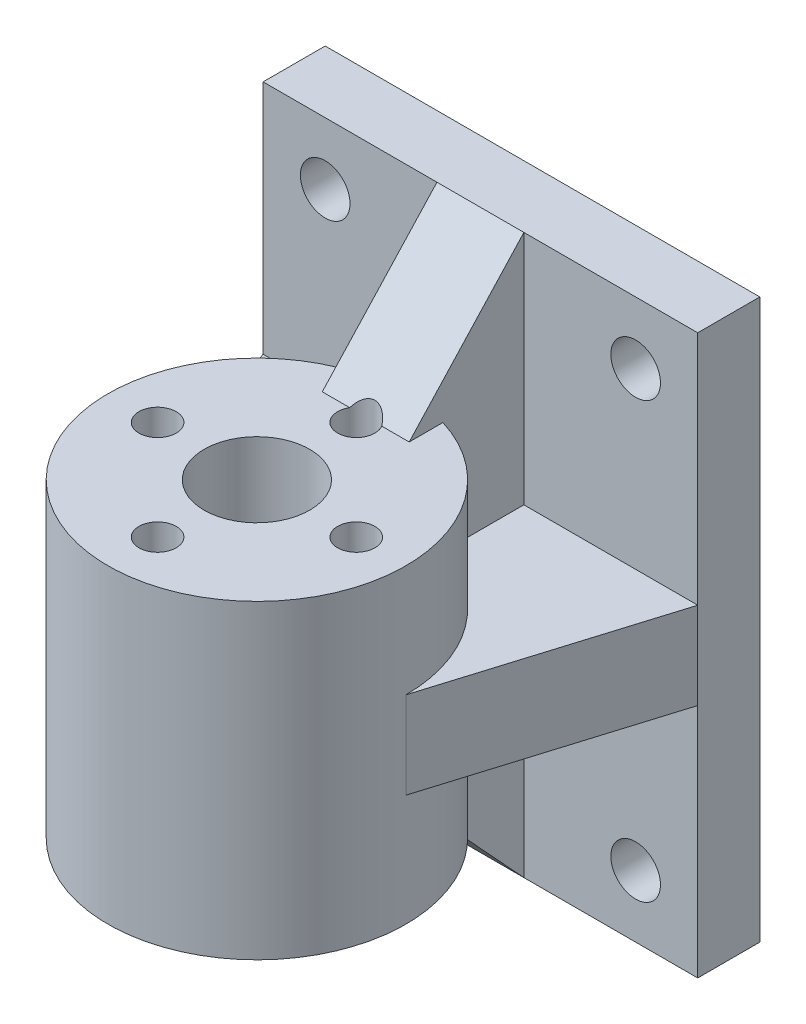
from build123d import *

# Parameters (mm, degrees)
SZKIC1_W                               = 35
SZKIC1_H                               = 5
DODANIE_WYCI_GNI_CIE1_DEPTH            = 45
DODANIE_WYCI_GNI_CIE2_START            = 10
SZKIC2_R                               = 12
SZKIC2_R_2                             = 4.25
DODANIE_WYCI_GNI_CIE2_DEPTH            = 25
DODANIE_WYCI_GNI_CIE3_START            = -14
DODANIE_WYCI_GNI_CIE3_DEPTH            = 7
DODANIE_WYCI_GNI_CIE4_START            = -19
DODANIE_WYCI_GNI_CIE4_DEPTH            = 7
WYTNIJ_WYCI_GNI_CIE1_REACH             = 61.634
SZKIC5_R                               = 2
WYTNIJ_WYCI_GNI_CIE2_REACH             = 51.308
SZKIC10_R                              = 1.5
WYTNIJ_WYCI_GNI_CIE2_DIRECTION_2_DEPTH = 3
SZYK_KO_OWY1_COUNT                     = 4
SFAZOWANIE1_SIZE                       = 1
SFAZOWANIE1_SIZE2                      = 0.624869352


with BuildPart() as part:
    # Szkic1 → Dodanie-wyciągnięcie1 (new body)
    with BuildSketch(Plane(origin=(0, 0, 0), x_dir=(1, 0, 0), z_dir=(0, 1, 0))):
        with Locations((0, 2.5)):
            Rectangle(SZKIC1_W, SZKIC1_H)
    extrude(amount=DODANIE_WYCI_GNI_CIE1_DEPTH)



with BuildPart() as body_2:
    # Szkic2 → Dodanie-wyciągnięcie2 (new body)
    with BuildSketch(Plane(origin=(0, 0, 0), x_dir=(1, 0, 0), z_dir=(0, 1, 0)).offset(DODANIE_WYCI_GNI_CIE2_START)):
        with Locations(Location((0, -18, 0), (0, 0, 270))):
            Circle(SZKIC2_R)
        with Locations(Location((0, -18, 0), (0, 0, 270))):
            Circle(SZKIC2_R_2, mode=Mode.SUBTRACT)
    extrude(amount=DODANIE_WYCI_GNI_CIE2_DEPTH)


with BuildPart() as part_1:
    add(part.part)

    add(body_2.part)  # Dodanie-wyciągnięcie3 merges body 2
    # Szkic3 → Dodanie-wyciągnięcie3 (add)
    with BuildSketch(Plane.ZY.offset(17.5).offset(DODANIE_WYCI_GNI_CIE3_START)):
        Polygon((0, 0), (0, 45), (9.234999726, 35), (9.234999726, 10), align=None)
    extrude(amount=-DODANIE_WYCI_GNI_CIE3_DEPTH)

    # Szkic4 → Dodanie-wyciągnięcie4 (add)
    with BuildSketch(Plane.XZ.offset(DODANIE_WYCI_GNI_CIE4_START)):
        Polygon((-17.5, 0), (-12, 18), (0, 9.234999726), (12, 18), (17.5, 0), align=None)
    extrude(amount=-DODANIE_WYCI_GNI_CIE4_DEPTH)

    # Szkic5 → Wytnij-wyciągnięcie1 (cut, up to next)
    with BuildSketch(Plane(origin=(0, 0, -5), x_dir=(-1, 0, 0), z_dir=(0, 0, -1)), mode=Mode.PRIVATE) as wytnij_wyci_gni_cie1_sk1:
        with Locations((-12.5, 40)):
            Circle(SZKIC5_R)
    wytnij_wyci_gni_cie1_tool1 = extrude(wytnij_wyci_gni_cie1_sk1.sketch, amount=-WYTNIJ_WYCI_GNI_CIE1_REACH, mode=Mode.PRIVATE) & part_1.part
    # Szkic5 → Wytnij-wyciągnięcie1 (cut, up to next)
    with BuildSketch(Plane(origin=(0, 0, -5), x_dir=(-1, 0, 0), z_dir=(0, 0, -1)), mode=Mode.PRIVATE) as wytnij_wyci_gni_cie1_sk2:
        with Locations((12.5, 40)):
            Circle(SZKIC5_R)
    wytnij_wyci_gni_cie1_tool2 = extrude(wytnij_wyci_gni_cie1_sk2.sketch, amount=-WYTNIJ_WYCI_GNI_CIE1_REACH, mode=Mode.PRIVATE) & part_1.part
    # Szkic5 → Wytnij-wyciągnięcie1 (cut, up to next)
    with BuildSketch(Plane(origin=(0, 0, -5), x_dir=(-1, 0, 0), z_dir=(0, 0, -1)), mode=Mode.PRIVATE) as wytnij_wyci_gni_cie1_sk3:
        with Locations((12.5, 5)):
            Circle(SZKIC5_R)
    wytnij_wyci_gni_cie1_tool3 = extrude(wytnij_wyci_gni_cie1_sk3.sketch, amount=-WYTNIJ_WYCI_GNI_CIE1_REACH, mode=Mode.PRIVATE) & part_1.part
    # Szkic5 → Wytnij-wyciągnięcie1 (cut, up to next)
    with BuildSketch(Plane(origin=(0, 0, -5), x_dir=(-1, 0, 0), z_dir=(0, 0, -1)), mode=Mode.PRIVATE) as wytnij_wyci_gni_cie1_sk4:
        with Locations((-12.5, 5)):
            Circle(SZKIC5_R)
    wytnij_wyci_gni_cie1_tool4 = extrude(wytnij_wyci_gni_cie1_sk4.sketch, amount=-WYTNIJ_WYCI_GNI_CIE1_REACH, mode=Mode.PRIVATE) & part_1.part
    add(wytnij_wyci_gni_cie1_tool1.solids().sort_by_distance((12.5, 40, -5))[0], mode=Mode.SUBTRACT)
    add(wytnij_wyci_gni_cie1_tool2.solids().sort_by_distance((-12.5, 40, -5))[0], mode=Mode.SUBTRACT)
    add(wytnij_wyci_gni_cie1_tool3.solids().sort_by_distance((-12.5, 5, -5))[0], mode=Mode.SUBTRACT)
    add(wytnij_wyci_gni_cie1_tool4.solids().sort_by_distance((12.5, 5, -5))[0], mode=Mode.SUBTRACT)

    # Szkic10 → Wytnij-wyciągnięcie2 (cut, up to next)
    with BuildSketch(Plane(origin=(0, 10, 0), x_dir=(-1, 0, 0), z_dir=(0, -1, 0)), mode=Mode.PRIVATE) as wytnij_wyci_gni_cie2_sk1:
        with Locations(Location((-8, -18, 0), (0, 0, 270))):
            Circle(SZKIC10_R)
    wytnij_wyci_gni_cie2_tool1 = extrude(wytnij_wyci_gni_cie2_sk1.sketch, amount=-WYTNIJ_WYCI_GNI_CIE2_REACH, mode=Mode.PRIVATE) & part_1.part
    wytnij_wyci_gni_cie2 = wytnij_wyci_gni_cie2_tool1.solids().sort_by_distance((8, 10, 18))[0]
    add(wytnij_wyci_gni_cie2, mode=Mode.SUBTRACT)

    # Szkic10 → Wytnij-wyciągnięcie2 direction 2 (cut)
    with BuildSketch(Plane(origin=(0, 10, 0), x_dir=(-1, 0, 0), z_dir=(0, -1, 0))):
        with Locations(Location((-8, -18, 0), (0, 0, 270))):
            Circle(SZKIC10_R)
    wytnij_wyci_gni_cie2_direction_2 = extrude(amount=WYTNIJ_WYCI_GNI_CIE2_DIRECTION_2_DEPTH, mode=Mode.SUBTRACT)

    # Szyk kołowy1: Wytnij-wyciągnięcie2, Wytnij-wyciągnięcie2 direction 2; each copy of Wytnij-wyciągnięcie2 runs up to whatever stops it at its own place
    szyk_ko_owy1_before = part_1.part  # the part as the pattern finds it: every copy runs up to it
    szyk_ko_owy1_wytnij_wyci_gni_cie2_long = extrude(wytnij_wyci_gni_cie2_sk1.sketch, amount=-WYTNIJ_WYCI_GNI_CIE2_REACH, mode=Mode.PRIVATE)
    szyk_ko_owy1_wytnij_wyci_gni_cie2_tool1 = szyk_ko_owy1_wytnij_wyci_gni_cie2_long.rotate(Axis((0, 0, 18), (0, 1, 0)), 1 * 360 / SZYK_KO_OWY1_COUNT) & szyk_ko_owy1_before
    add(szyk_ko_owy1_wytnij_wyci_gni_cie2_tool1.solids().sort_by_distance((0, 10, 10))[0], mode=Mode.SUBTRACT)
    szyk_ko_owy1_wytnij_wyci_gni_cie2_tool2 = szyk_ko_owy1_wytnij_wyci_gni_cie2_long.rotate(Axis((0, 0, 18), (0, 1, 0)), 2 * 360 / SZYK_KO_OWY1_COUNT) & szyk_ko_owy1_before
    add(szyk_ko_owy1_wytnij_wyci_gni_cie2_tool2.solids().sort_by_distance((-8, 10, 18))[0], mode=Mode.SUBTRACT)
    szyk_ko_owy1_wytnij_wyci_gni_cie2_tool3 = szyk_ko_owy1_wytnij_wyci_gni_cie2_long.rotate(Axis((0, 0, 18), (0, 1, 0)), 3 * 360 / SZYK_KO_OWY1_COUNT) & szyk_ko_owy1_before
    add(szyk_ko_owy1_wytnij_wyci_gni_cie2_tool3.solids().sort_by_distance((0, 10, 26))[0], mode=Mode.SUBTRACT)
    add(wytnij_wyci_gni_cie2_direction_2.rotate(Axis((0, 0, 18), (0, 1, 0)), 1 * 360 / SZYK_KO_OWY1_COUNT), mode=Mode.SUBTRACT)
    add(wytnij_wyci_gni_cie2_direction_2.rotate(Axis((0, 0, 18), (0, 1, 0)), 2 * 360 / SZYK_KO_OWY1_COUNT), mode=Mode.SUBTRACT)
    add(wytnij_wyci_gni_cie2_direction_2.rotate(Axis((0, 0, 18), (0, 1, 0)), 3 * 360 / SZYK_KO_OWY1_COUNT), mode=Mode.SUBTRACT)

    # Sfazowanie1
    sfazowanie1_edges = [part_1.edges().sort_by_distance(p)[0] for p in [
        (0, 10, 13.75),
    ]]
    sfazowanie1_side = [part_1.faces().sort_by_distance(p)[0] for p in [
        (0, 22.5, 13.75),
    ]]
    chamfer(sfazowanie1_edges, length=SFAZOWANIE1_SIZE, length2=SFAZOWANIE1_SIZE2, reference=sfazowanie1_side[0])


solid = part_1.part
